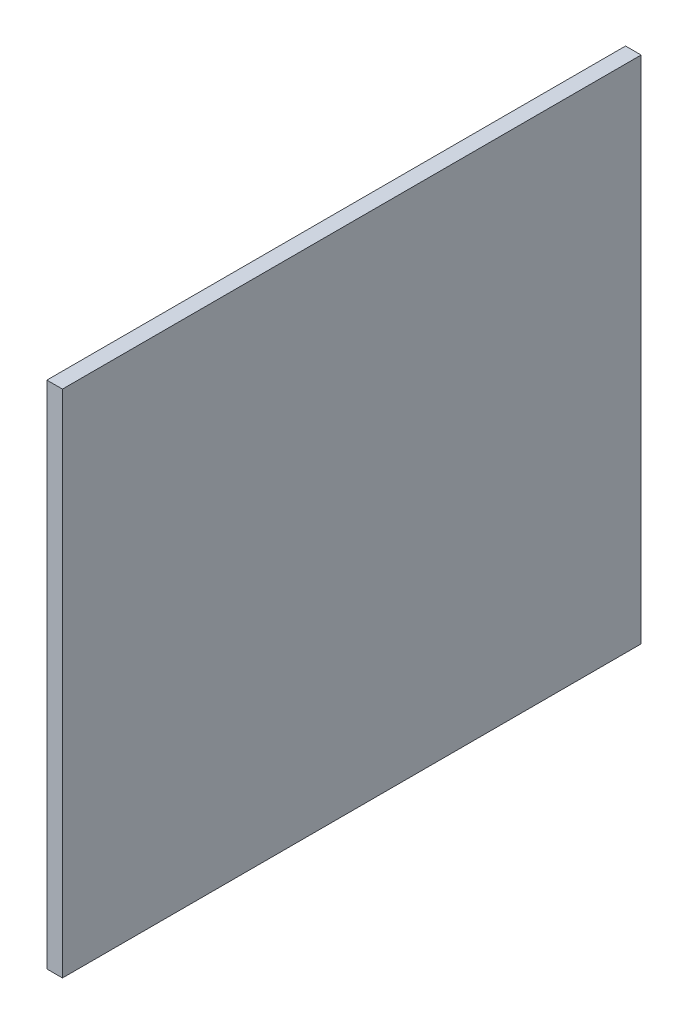
from build123d import *

# Parameters (mm, degrees)
SKETCH1_W           = 118
SKETCH1_H           = 104
BOSS_EXTRUDE1_DEPTH = 3.175


with BuildPart() as part:
    # Sketch1 → Boss-Extrude1 (new body)
    with BuildSketch(Plane(origin=(0, 0, 0), x_dir=(0, 0, -1), z_dir=(1, 0, 0))):
        Rectangle(SKETCH1_W, SKETCH1_H)
    extrude(amount=BOSS_EXTRUDE1_DEPTH)


solid = part.part
